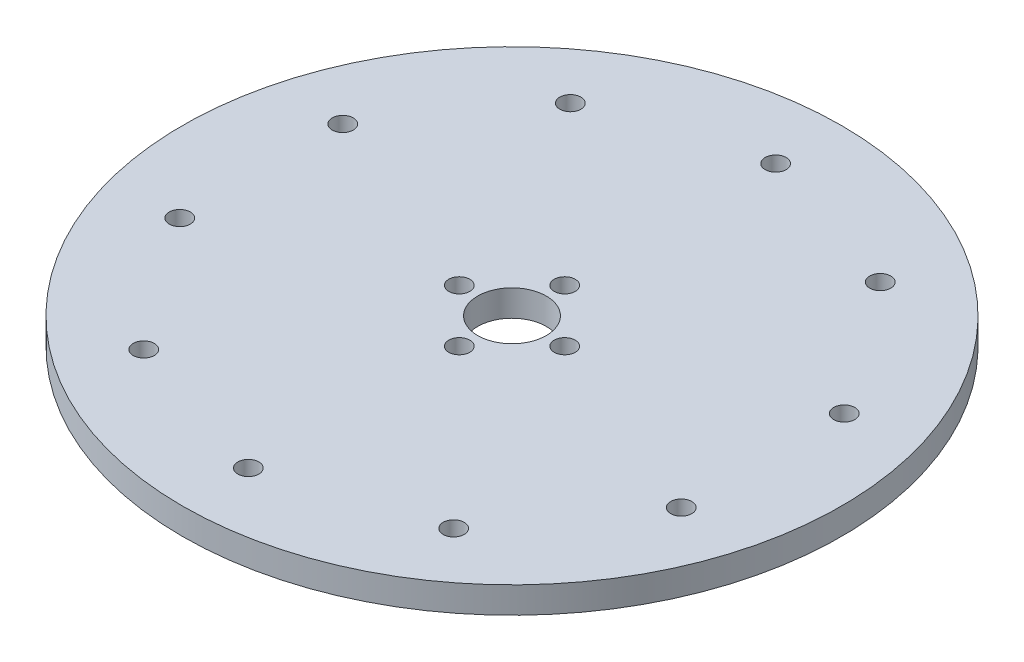
from build123d import *

# Parameters (mm, degrees)
SKETCH_1_R          = 50
EXTRUDE_1_DEPTH     = 4
SKETCH_2_R          = 1.6
SKETCH_2_R_2        = 5.2
CUT_EXTRUDE_1_DEPTH = 4
SKETCH_3_R          = 1.6
CUT_EXTRUDE_2_DEPTH = 10


with BuildPart() as part:
    # 草图1 → 凸台-拉伸1 (new body)
    with BuildSketch(Plane(origin=(0, 0, 0), x_dir=(1, 0, 0), z_dir=(0, 1, 0))):
        with Locations(Location((0, 0, 0), (0, 0, 270))):
            Circle(SKETCH_1_R)
    extrude(amount=EXTRUDE_1_DEPTH)

    # 草图2 → 切除-拉伸1 (cut)
    with BuildSketch(Plane(origin=(0, 4, 0), x_dir=(1, 0, 0), z_dir=(0, 1, 0))):
        with Locations(Location((0, 8, 0), (0, 0, 270))):
            Circle(SKETCH_2_R)
        with Locations(Location((8, 0, 0), (0, 0, 270))):
            Circle(SKETCH_2_R)
        with Locations(Location((0, -8, 0), (0, 0, 270))):
            Circle(SKETCH_2_R)
        with Locations(Location((-8, 0, 0), (0, 0, 270))):
            Circle(SKETCH_2_R)
        with Locations(Location((0, 0, 0), (0, 0, 270))):
            Circle(SKETCH_2_R_2)
    extrude(amount=-CUT_EXTRUDE_1_DEPTH, mode=Mode.SUBTRACT)

    # 草图3 → 切除-拉伸2 (cut)
    with BuildSketch(Plane(origin=(0, 4, 0), x_dir=(1, 0, 0), z_dir=(0, 1, 0))):
        with Locations(Location((0, 40, 0), (0, 0, 270))):
            Circle(SKETCH_3_R)
        with Locations(Location((23.511410092, 32.360679775, 0), (0, 0, 270))):
            Circle(SKETCH_3_R)
        with Locations(Location((38.042260652, 12.360679775, 0), (0, 0, 270))):
            Circle(SKETCH_3_R)
        with Locations(Location((38.042260652, -12.360679775, 0), (0, 0, 270))):
            Circle(SKETCH_3_R)
        with Locations(Location((23.511410092, -32.360679775, 0), (0, 0, 270))):
            Circle(SKETCH_3_R)
        with Locations(Location((0, -40, 0), (0, 0, 270))):
            Circle(SKETCH_3_R)
        with Locations(Location((-23.511410092, -32.360679775, 0), (0, 0, 270))):
            Circle(SKETCH_3_R)
        with Locations(Location((-38.042260652, -12.360679775, 0), (0, 0, 270))):
            Circle(SKETCH_3_R)
        with Locations(Location((-38.042260652, 12.360679775, 0), (0, 0, 270))):
            Circle(SKETCH_3_R)
        with Locations(Location((-23.511410092, 32.360679775, 0), (0, 0, 270))):
            Circle(SKETCH_3_R)
    extrude(amount=-CUT_EXTRUDE_2_DEPTH, mode=Mode.SUBTRACT)


solid = part.part
